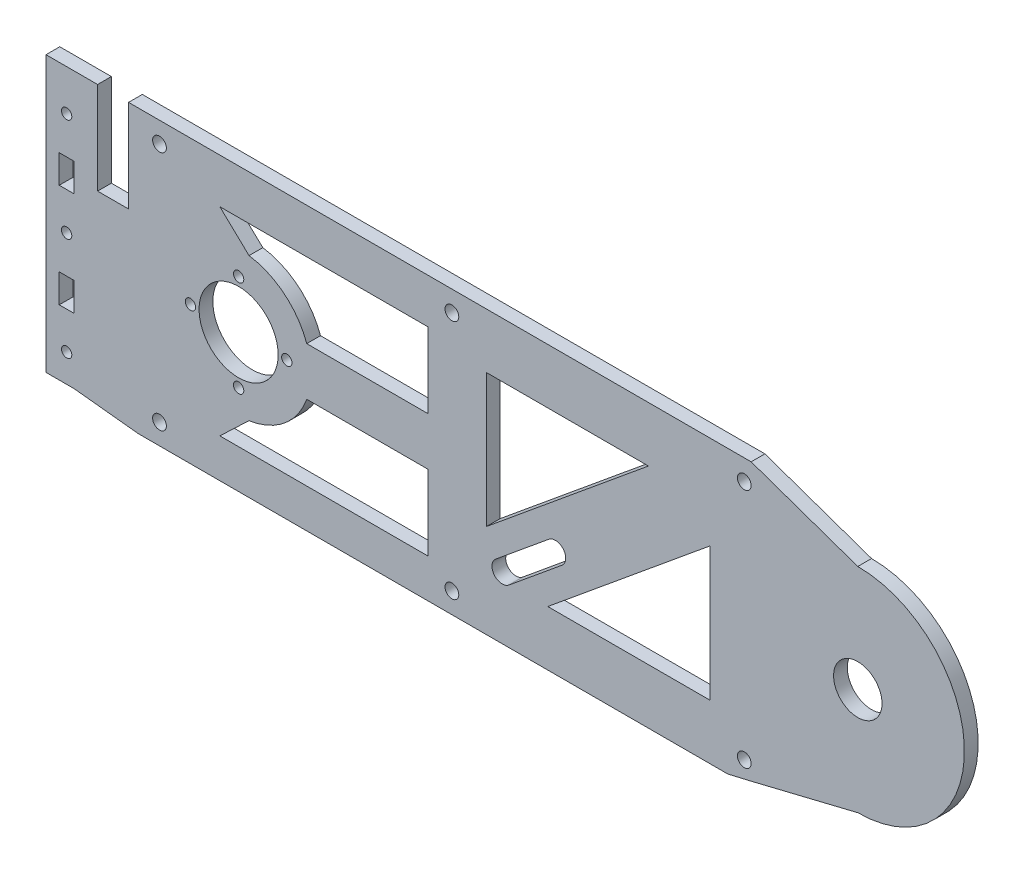
from build123d import *

# Parameters (mm, degrees)
SKETCH_1_R          = 1.5
SKETCH_1_R_2        = 11.5
SKETCH_1_R_3        = 7.04
SKETCH_1_W          = 4.3
SKETCH_1_H          = 8.2
SKETCH_1_H_2        = 8.3
EXTRUDE_1_DEPTH     = 4
SKETCH_2_R          = 2
CUT_EXTRUDE_1_DEPTH = 4


with BuildPart() as part:
    # 草图1 → 凸台-拉伸1 (new body)
    with BuildSketch(Plane.XY):
        with BuildLine():
            Line((-5.457142857, -0.095714286), (-5.457142857, 41.754285714))
            Line((-5.457142857, 41.754285714), (9.542857143, 41.754285714))
            Line((9.542857143, 41.754285714), (9.542857143, 14.904285714))
            Line((9.542857143, 14.904285714), (18.542857143, 14.904285714))
            Line((18.542857143, 14.904285714), (18.542857143, 41.754285714))
            Line((18.542857143, 41.754285714), (199.542857143, 41.754285714))
            Line((199.542857143, 41.754285714), (230.542857143, 30.904285714))
            ThreePointArc((230.542857143, 30.904285714), (261.542857143, -0.095714286), (230.542857143, -31.095714286))
            Line((230.542857143, -31.095714286), (199.556073527, -38.65591431))
            Line((199.556073527, -38.65591431), (192.746868021, -40.245714286))
            Line((192.746868021, -40.245714286), (21.365844759, -40.245714286))
            Line((21.365844759, -40.245714286), (2.692857143, -38.245714286))
            Line((2.692857143, -38.245714286), (-5.457142857, -38.245714286))
            Line((-5.457142857, -38.245714286), (-5.457142857, -0.095714286))
        make_face()
        with Locations((0.542857143, 29.904285714)):
            Circle(SKETCH_1_R, mode=Mode.SUBTRACT)
        with Locations((0.542857143, -0.095714286)):
            Circle(SKETCH_1_R, mode=Mode.SUBTRACT)
        with Locations((0.542857143, -30.095714286)):
            Circle(SKETCH_1_R, mode=Mode.SUBTRACT)
        with Locations((50.542857143, -0.095714286)):
            Circle(SKETCH_1_R_2, mode=Mode.SUBTRACT)
        with Locations((50.542857143, -14.095714286)):
            Circle(SKETCH_1_R, mode=Mode.SUBTRACT)
        with Locations((36.542857143, -0.095714286)):
            Circle(SKETCH_1_R, mode=Mode.SUBTRACT)
        with Locations((50.542857143, 13.904285714)):
            Circle(SKETCH_1_R, mode=Mode.SUBTRACT)
        with Locations((64.542857143, -0.095714286)):
            Circle(SKETCH_1_R, mode=Mode.SUBTRACT)
        with Locations((230.542857143, -0.095714286)):
            Circle(SKETCH_1_R_3, mode=Mode.SUBTRACT)
        with Locations((0.542857143, 14.904285714)):
            Rectangle(SKETCH_1_W, SKETCH_1_H, mode=Mode.SUBTRACT)
        with Locations((0.542857143, -15.145714286)):
            Rectangle(SKETCH_1_W, SKETCH_1_H_2, mode=Mode.SUBTRACT)
    extrude(amount=EXTRUDE_1_DEPTH)

    # 草图2 → 切除-拉伸1 (cut)
    with BuildSketch(Plane.XY.offset(4)):
        with Locations((27.542857143, 35.754285714)):
            Circle(SKETCH_2_R)
        with Locations((112.542857143, 35.754285714)):
            Circle(SKETCH_2_R)
        with Locations((197.542857143, 35.754285714)):
            Circle(SKETCH_2_R)
        with Locations((112.542857143, -34.245714286)):
            Circle(SKETCH_2_R)
        with Locations((197.542857143, -34.245714286)):
            Circle(SKETCH_2_R)
        with Locations((27.542857143, -34.245714286)):
            Circle(SKETCH_2_R)
        Polygon((187.542857143, -24.245714286), (140.41622539, -24.245714286), (187.542857143, 14.56445304), align=None)
        Polygon((122.542857143, 25.754285714), (169.669488896, 25.754285714), (122.542857143, -13.055881612), align=None)
        with BuildLine():
            Line((70.341847016, 6.904285714), (105.542857143, 6.904285714))
            Line((105.542857143, 6.904285714), (105.542857143, 28.754285714))
            Line((105.542857143, 28.754285714), (45.074625519, 28.754285714))
            Line((45.074625519, 28.754285714), (53.568409163, 20.685191252))
            ThreePointArc((53.568409163, 20.685191252), (63.873958655, 16.130244314), (70.341847016, 6.904285714))
        make_face()
        with BuildLine():
            Line((105.542857143, -7.095714286), (105.542857143, -28.945714286))
            Line((105.542857143, -28.945714286), (45.074625519, -28.945714286))
            Line((45.074625519, -28.945714286), (53.568409163, -20.876619824))
            ThreePointArc((53.568409163, -20.876619824), (63.873958655, -16.321672885), (70.341847016, -7.095714286))
            Line((70.341847016, -7.095714286), (105.542857143, -7.095714286))
        make_face()
        with BuildLine():
            Line((125.279005787, -19.870759717), (140.7176105, -7.15661466))
            ThreePointArc((140.7176105, -7.15661466), (144.940522965, -7.565283608), (144.531854017, -11.788196074))
            Line((144.531854017, -11.788196074), (129.093249305, -24.502341131))
            ThreePointArc((129.093249305, -24.502341131), (124.870336839, -24.093672183), (125.279005787, -19.870759717))
        make_face()
    extrude(amount=-CUT_EXTRUDE_1_DEPTH, mode=Mode.SUBTRACT)


solid = part.part
